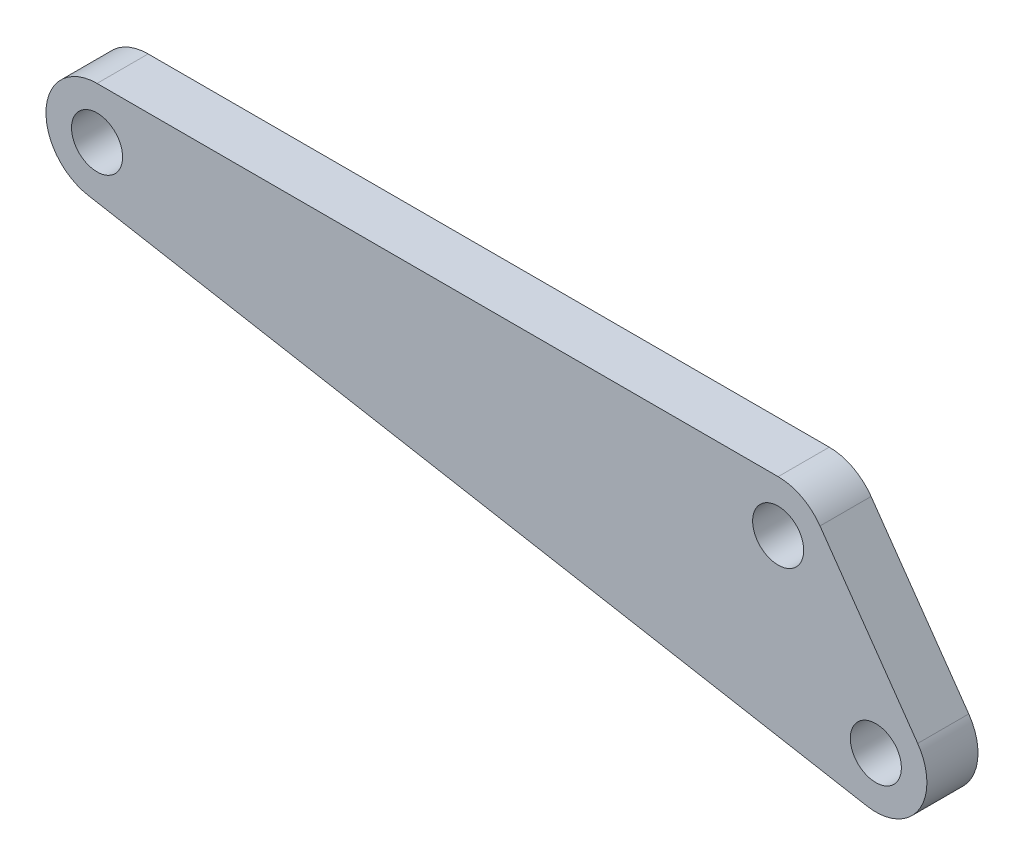
from build123d import *

# Parameters (mm, degrees)
SKETCH2_R           = 1.5
BOSS_EXTRUDE1_DEPTH = 3


with BuildPart() as part:
    # Sketch2 → Boss-Extrude1 (new body)
    with BuildSketch(Plane.XY):
        with BuildLine():
            Line((-40, 3), (0, 3))
            ThreePointArc((0, 3), (1.38524584, 2.6610325), (2.457456133, 1.720729309))
            Line((2.457456133, 1.720729309), (8.193220496, -6.470791134))
            ThreePointArc((8.193220496, -6.470791134), (8.263765734, -9.806825081), (5.206864544, -11.144529922))
            Line((5.206864544, -11.144529922), (-40.528899819, -2.953009479))
            ThreePointArc((-40.528899819, -2.953009479), (-42.988229278, 0.265491586), (-40, 3))
        make_face()
        with Locations((-40, 0)):
            Circle(SKETCH2_R, mode=Mode.SUBTRACT)
        Circle(SKETCH2_R, mode=Mode.SUBTRACT)
        with Locations((5.735764364, -8.191520443)):
            Circle(SKETCH2_R, mode=Mode.SUBTRACT)
    extrude(amount=BOSS_EXTRUDE1_DEPTH)


solid = part.part
